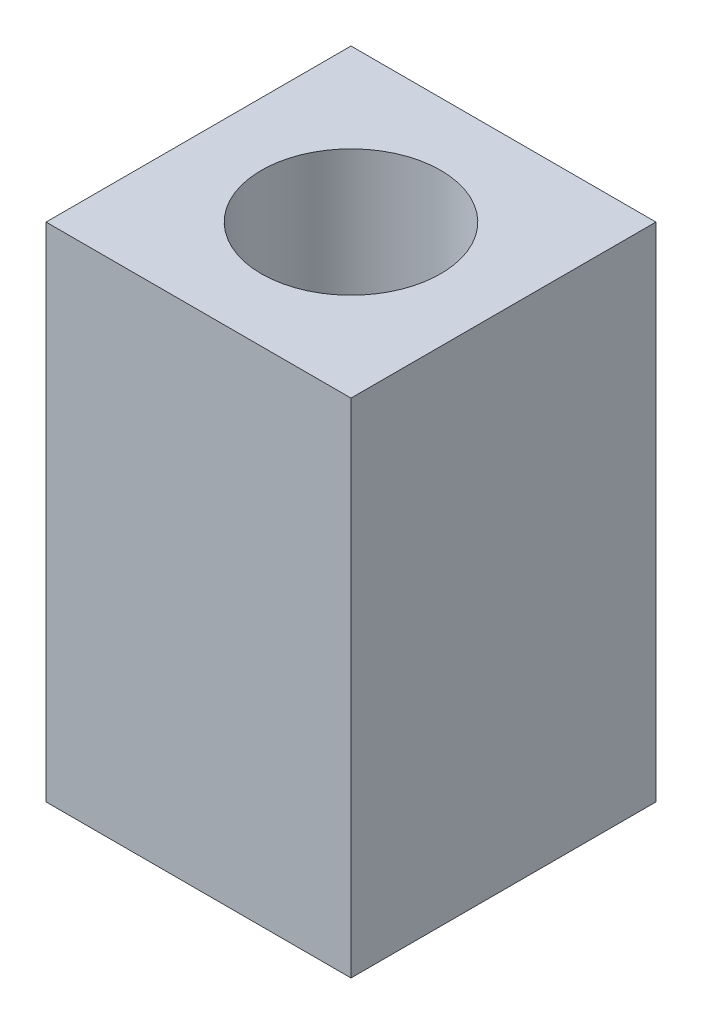
from build123d import *

# Parameters (mm, degrees)
SKETCH_1_W          = 85
SKETCH_1_H          = 85
EXTRUDE_1_DEPTH     = 70
SKETCH_2_R          = 25
CUT_EXTRUDE_1_DEPTH = 140


with BuildPart() as part:
    # 草图1 → 凸台-拉伸1 (new, symmetric)
    with BuildSketch(Plane(origin=(0, 0, 0), x_dir=(1, 0, 0), z_dir=(0, 1, 0))):
        Rectangle(SKETCH_1_W, SKETCH_1_H)
    extrude(amount=EXTRUDE_1_DEPTH, both=True)

    # 草图2 → 切除-拉伸1 (cut)
    with BuildSketch(Plane(origin=(0, 70, 0), x_dir=(1, 0, 0), z_dir=(0, 1, 0))):
        with Locations(Location((0, 0, 0), (0, 0, 270))):
            Circle(SKETCH_2_R)
    extrude(amount=-CUT_EXTRUDE_1_DEPTH, mode=Mode.SUBTRACT)


solid = part.part
